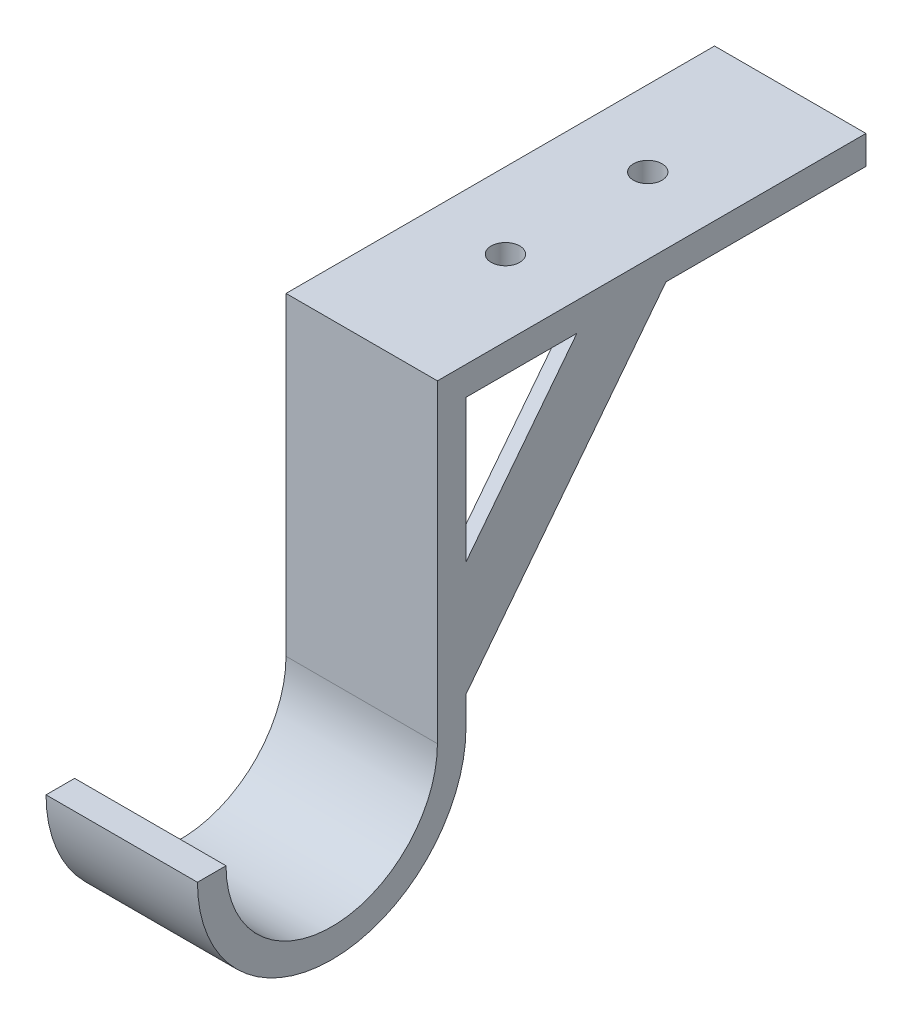
from build123d import *

# Parameters (mm, degrees)
BOSS_EXTRUDE1_DEPTH  = 2.54
SKETCH2_R            = 1.27
CUT_EXTRUDE1_DEPTH   = 5.334
SKETCH3_W            = 13.462
SKETCH3_H            = 27.94
BOSS_EXTRUDE2_DEPTH  = 2.54
BOSS_EXTRUDE3_DEPTH  = 13.462
BOSS_EXTRUDE7_DEPTH  = 1.27
BOSS_EXTRUDE12_DEPTH = 1.27


with BuildPart() as part:
    # Sketch1 → Boss-Extrude1 (new body)
    with BuildSketch(Plane(origin=(0, 0, 0), x_dir=(1, 0, 0), z_dir=(0, 1, 0))):
        Polygon((0, 0), (6.731, 0), (6.731, 38.1), (-6.731, 38.1), (-6.731, 0), align=None)
    extrude(amount=BOSS_EXTRUDE1_DEPTH)

    # Sketch2 → Cut-Extrude1 (cut)
    with BuildSketch(Plane(origin=(0, 2.54, 0), x_dir=(1, 0, 0), z_dir=(0, 1, 0))):
        with Locations(Location((0, 25.429147729, 0), (0, 0, 270))):
            Circle(SKETCH2_R)
        with Locations(Location((0, 12.776292729, 0), (0, 0, 270))):
            Circle(SKETCH2_R)
    extrude(amount=-CUT_EXTRUDE1_DEPTH, mode=Mode.SUBTRACT)

    # Sketch3 → Boss-Extrude2 (add)
    with BuildSketch(Plane.XY):
        with Locations((0, -11.43)):
            Rectangle(SKETCH3_W, SKETCH3_H)
    extrude(amount=-BOSS_EXTRUDE2_DEPTH)

    # Sketch4 → Boss-Extrude3 (add)
    with BuildSketch(Plane.ZY.offset(6.731)):
        with BuildLine():
            Line((0, -25.4), (-2.54, -25.4))
            ThreePointArc((-2.54, -25.4), (9.398, -37.338), (21.336, -25.4))
            Line((21.336, -25.4), (18.796, -25.4))
            ThreePointArc((18.796, -25.4), (9.398, -34.798), (0, -25.4))
        make_face()
    extrude(amount=-BOSS_EXTRUDE3_DEPTH)

    # Sketch8 → Boss-Extrude7 (add)
    with BuildSketch(Plane(origin=(6.731, 0, 0), x_dir=(0, 0, -1), z_dir=(1, 0, 0))):
        Polygon((2.54, -22.86), (20.32, 0), (12.400973841, 0), (2.54, -12.678394938), align=None)
    extrude(amount=-BOSS_EXTRUDE7_DEPTH)

    # Sketch9 → Boss-Extrude12 (add)
    with BuildSketch(Plane.ZY.offset(6.731)):
        Polygon((-2.54, -12.678394938), (-2.54, -22.86), (-20.32, 0), (-12.400973841, 0), align=None)
    extrude(amount=-BOSS_EXTRUDE12_DEPTH)


solid = part.part
